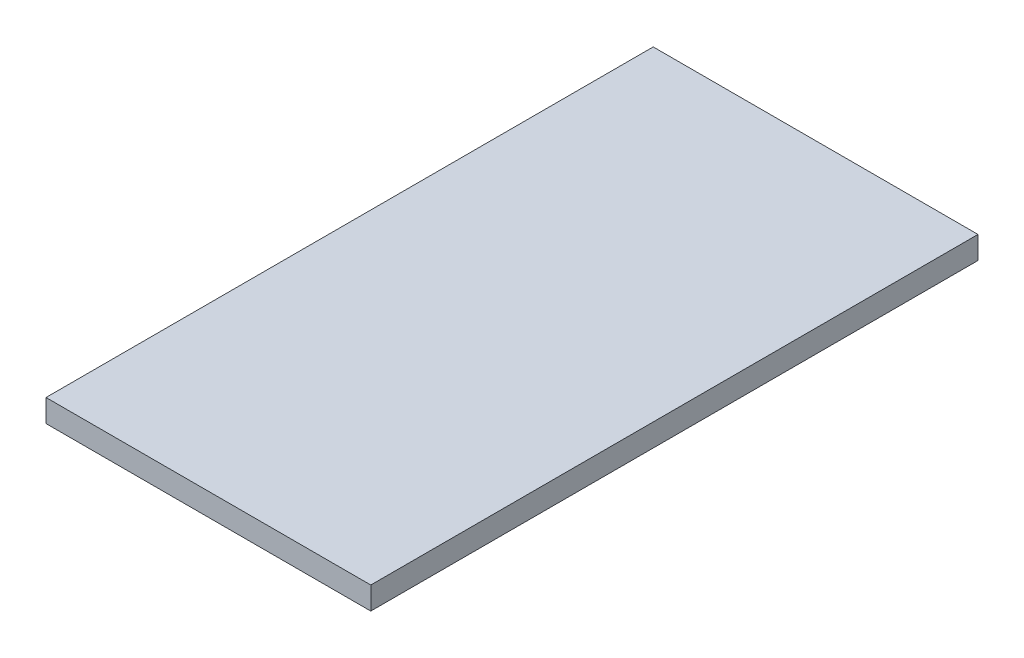
from build123d import *

# Parameters (mm, degrees)
SKETCH_1_W      = 23
SKETCH_1_H      = 43
EXTRUDE_1_DEPTH = 1.6


with BuildPart() as part:
    # 草图1 → 凸台-拉伸1 (new body)
    with BuildSketch(Plane(origin=(0, 0, 0), x_dir=(1, 0, 0), z_dir=(0, 1, 0))):
        Rectangle(SKETCH_1_W, SKETCH_1_H)
    extrude(amount=EXTRUDE_1_DEPTH)


solid = part.part
